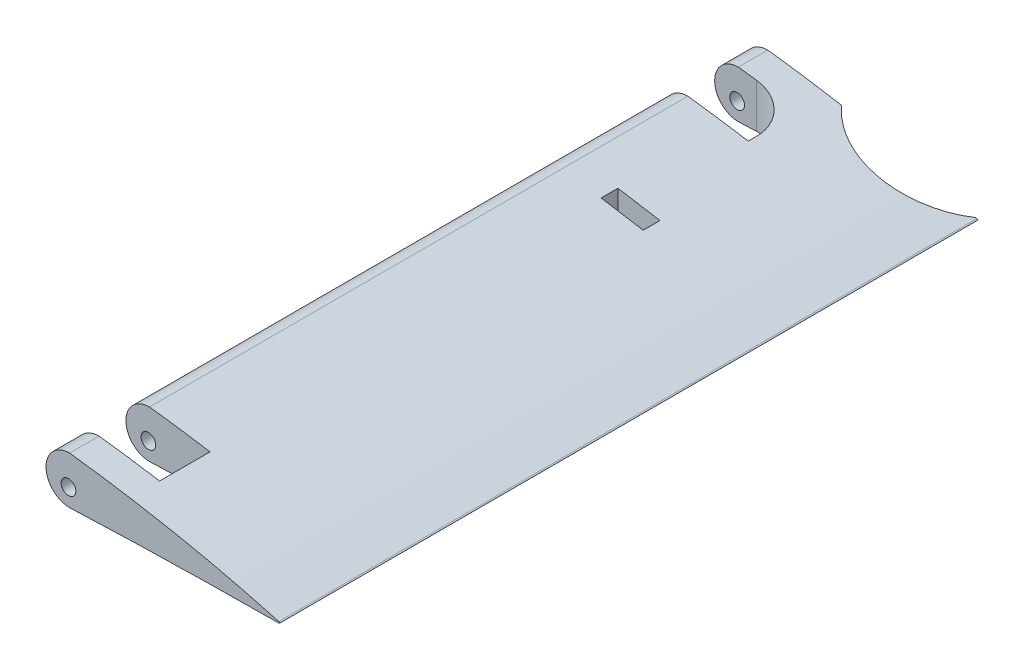
from build123d import *

# Parameters (mm, degrees)
EXTRUDE_1_DEPTH          = 185
SKETCH_2_R               = 3.25
CUT_EXTRUDE_1_DEPTH      = 221.978766148
CUT_EXTRUDE_2_DEPTH      = 221.978766148
CUT_EXTRUDE_2_DEPTH_BACK = 221.978766148
EXTRUDE_2_DEPTH          = 166
SKETCH_6_R               = 1.75
CUT_EXTRUDE_3_DEPTH      = 206.235651098
CUT_EXTRUDE_4_DEPTH      = 216.057370215
CUT_EXTRUDE_4_DEPTH_BACK = 216.057370215
SKETCH_7_W               = 10
SKETCH_7_H               = 4
SKETCH_7_W_2             = 20
SKETCH_7_H_2             = 12
CUT_EXTRUDE_6_DEPTH      = 216.057370215
CUT_EXTRUDE_6_DEPTH_BACK = 216.057370215
SKETCH_9_R               = 21.288089845
FILLET_1_R               = 10


with BuildPart() as part:
    # 草圖4 → 填料-伸長1 (new body)
    with BuildSketch(Plane.XY):
        with BuildLine():
            add(Edge.make_bspline(
                [(120, 0.156), (120.550064826, 0), (120, -0.156)],
                knots=[0, 0, 0, 1, 1, 1], degree=2))
            add(Edge.make_bspline(
                [(120, 0.156), (118.002062038, 0.699883829), (114.015827899, 1.785026774), (106.030245524, 3.758084328), (96.043999536, 5.938072944), (84.032443886, 8.087020219), (72.030199863, 9.848487706), (60.021268297, 11.104941512), (48.013383082, 11.888579605), (37.989056271, 11.896504921), (29.98519837, 11.342771412), (23.974194566, 10.613404695), (17.950199351, 9.537800408), (12.958326827, 8.244233687), (8.958076554, 6.937785184), (5.941795374, 5.704437414), (3.368139922, 4.370604372), (1.134204878, 2.77510484), (-0.810450078, 0.209036715), (1.28854905, -1.753439419), (3.430370135, -2.523784281), (5.981131747, -3.043733145), (8.993574888, -3.308089705), (12.998336856, -3.495180047), (18.001252309, -3.481166853), (24.002604177, -3.313228981), (29.999721531, -2.993463999), (37.999752898, -2.619308415), (47.998084378, -2.139166009), (60.000346089, -1.688308544), (71.998752124, -1.187669763), (83.99830623, -0.761253895), (95.998821653, -0.44759827), (105.999699706, -0.288346287), (113.999817607, -0.183470629), (117.999975201, -0.165156712), (120, -0.156)],
                knots=[0, 0, 0, 0, 0.025304886, 0.050487653, 0.100520433, 0.150190716, 0.199586607, 0.248740009, 0.297715539, 0.346600594, 0.371102737, 0.395726297, 0.420570145, 0.445825119, 0.458702216, 0.471919982, 0.485786003, 0.493461051, 0.506863029, 0.51614777, 0.522766003, 0.535269014, 0.547551134, 0.559786371, 0.584228898, 0.60868081, 0.633151284, 0.657621757, 0.706558114, 0.75548187, 0.804405627, 0.853320224, 0.902221408, 0.951113136, 0.975557228, 1, 1, 1, 1], degree=3))
        make_face()
    extrude(amount=EXTRUDE_1_DEPTH)

    # 草圖2 → 除料-伸長1 (cut, through all)
    with BuildSketch(Plane(origin=(0, 0, 0), x_dir=(-1, 0, 0), z_dir=(0, 0, -1))):
        with Locations((-25, 5)):
            Circle(SKETCH_2_R)
        with Locations((-50, 5)):
            Circle(SKETCH_2_R)
    extrude(amount=-CUT_EXTRUDE_1_DEPTH, mode=Mode.SUBTRACT)

    # 草圖3 → 除料-伸長2 (cut, two sides: drawn at the far end of the back side and taken through both)
    with BuildSketch(Plane(origin=(0, 0, 0), x_dir=(1, 0, 0), z_dir=(0, 1, 0)).offset(-CUT_EXTRUDE_2_DEPTH_BACK)):
        Polygon((70.275032413, -12), (120.275032413, -12), (166.480451747, 19.353311424), (-21.771072244, 70.933366938), (-60.731552483, -48.361554858), (-45.023238503, -192.444996011), (84.857900861, -230.57523876), (139.860309741, -200.53846228), (120.275032413, -178), (70.275032413, -178), align=None)
    extrude(amount=CUT_EXTRUDE_2_DEPTH + CUT_EXTRUDE_2_DEPTH_BACK, mode=Mode.SUBTRACT)

    # 草圖5 → 填料-伸長2 (add, through all)
    with BuildSketch(Plane.XY.offset(178)):
        with BuildLine():
            Line((70.275032413, 9.979427787), (70.275032413, -1.267341491))
            ThreePointArc((70.275032413, -1.267341491), (64.651647774, 4.356043148), (70.275032413, 9.979427787))
        make_face()
    extrude(amount=-EXTRUDE_2_DEPTH)

    # 草圖6 → 除料-伸長3 (cut, through all)
    with BuildSketch(Plane.XY.offset(178)):
        with Locations((70, 2.844)):
            Circle(SKETCH_6_R)
    extrude(amount=-CUT_EXTRUDE_3_DEPTH, mode=Mode.SUBTRACT)

    # 草圖7 → 除料-伸長4 (cut, two sides: drawn at the far end of the back side and taken through both)
    with BuildSketch(Plane(origin=(0, 0, 0), x_dir=(1, 0, 0), z_dir=(0, 1, 0)).offset(-CUT_EXTRUDE_4_DEPTH_BACK)):
        with Locations((84.651647774, -59)):
            Rectangle(SKETCH_7_W, SKETCH_7_H)
        with Locations((74.651647774, -25)):
            Rectangle(SKETCH_7_W_2, SKETCH_7_H_2)
        with Locations((74.651647774, -165)):
            Rectangle(SKETCH_7_W_2, SKETCH_7_H_2)
    extrude(amount=CUT_EXTRUDE_4_DEPTH + CUT_EXTRUDE_4_DEPTH_BACK, mode=Mode.SUBTRACT)

    # 草圖9 → 除料-伸長6 (cut, two sides: drawn at the far end of the back side and taken through both)
    with BuildSketch(Plane(origin=(0, 0, 0), x_dir=(1, 0, 0), z_dir=(0, 1, 0)).offset(-CUT_EXTRUDE_6_DEPTH_BACK)):
        with Locations((103.803043975, 2.084988425)):
            Circle(SKETCH_9_R)
    extrude(amount=CUT_EXTRUDE_6_DEPTH + CUT_EXTRUDE_6_DEPTH_BACK, mode=Mode.SUBTRACT)

    # 圓角1
    fillet_1_edges = [part.edges().sort_by_distance(p)[0] for p in [
        (84.651647774, 3.58065081, 19),
    ]]
    fillet(fillet_1_edges, radius=FILLET_1_R)


solid = part.part
